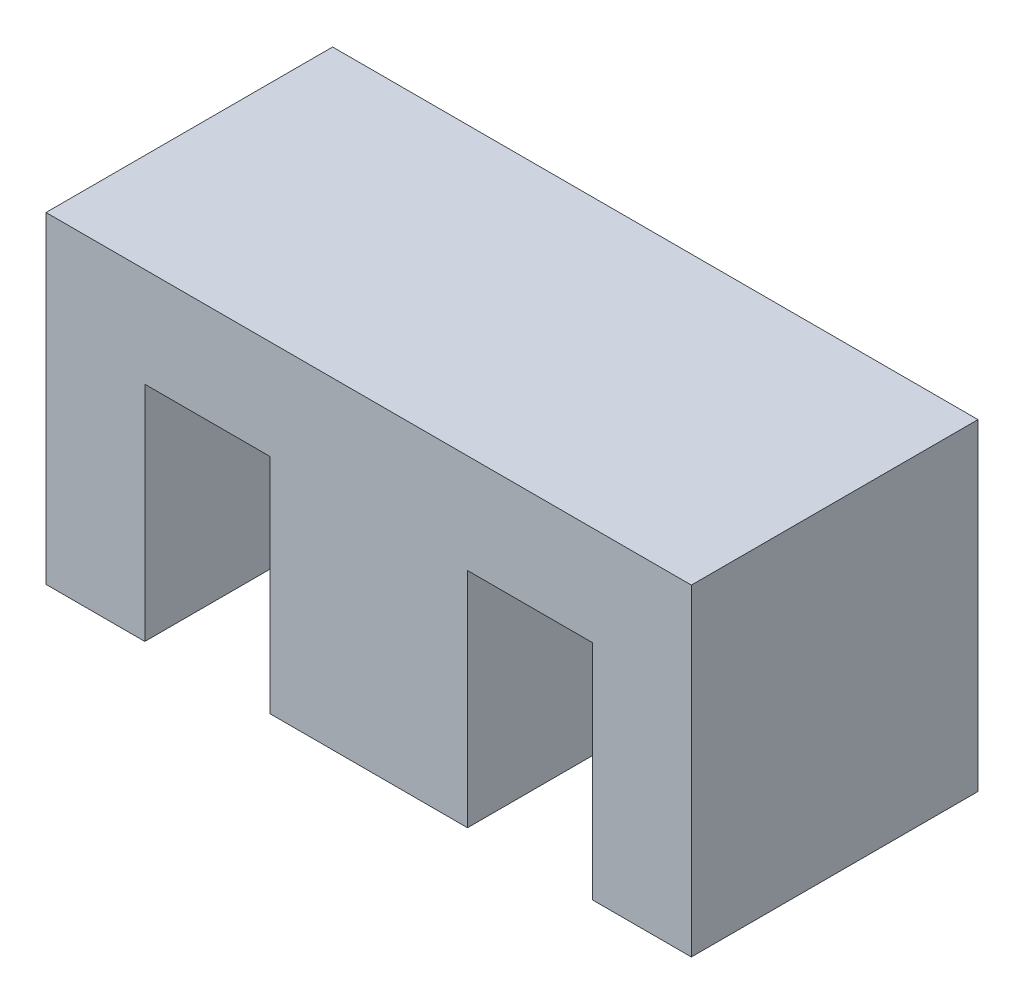
from build123d import *

# Parameters (mm, degrees)
EXTRUDE2_DEPTH = 24.65


with BuildPart() as part:
    # Sketch2 → Extrude2 (new body)
    with BuildSketch(Plane.XY):
        Polygon((-23.220199039, -35.064091922), (-23.220199039, -54.224091922), (-14.720199039, -54.224091922), (-14.720199039, -26.524091922), (-70.220199039, -26.524091922), (-70.220199039, -54.224091922), (-61.720199039, -54.224091922), (-61.720199039, -35.064091922), (-50.970199039, -35.064091922), (-50.970199039, -54.224091922), (-33.970199039, -54.224091922), (-33.970199039, -35.064091922), align=None)
    extrude(amount=EXTRUDE2_DEPTH)


solid = part.part
